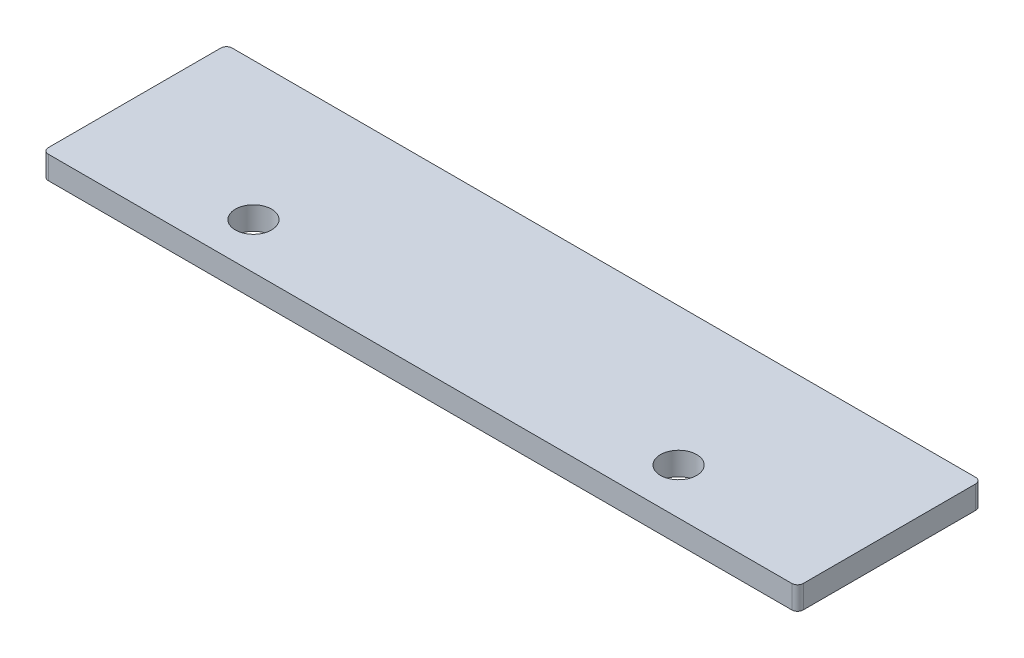
from build123d import *

# Parameters (mm, degrees)
SKETCH_1_W        = 65.7
SKETCH_1_H        = 16
EXTRUDE_1_DEPTH   = 2
FILLET_1_R        = 0.5
HOLE_WIZARD_M31_D = 3.15


with BuildPart() as part:
    # Эскиз1 → Бобышка-Вытянуть1 (new body)
    with BuildSketch(Plane(origin=(0, 0, 0), x_dir=(1, 0, 0), z_dir=(0, 1, 0))):
        Rectangle(SKETCH_1_W, SKETCH_1_H)
    extrude(amount=-EXTRUDE_1_DEPTH)

    # Скругление1
    fillet_1_edges = [part.edges().sort_by_distance(p)[0] for p in [
        (32.85, -1, 8),
        (-32.85, -1, 8),
        (-32.85, -1, -8),
        (32.85, -1, -8),
    ]]
    fillet(fillet_1_edges, radius=FILLET_1_R)

    # Сверло под метчик  спиральное M31 (through all)
    with Locations(Plane(origin=(0, 0, 0), x_dir=(1, 0, 0), z_dir=(0, 1, 0))):
        with Locations((18.5, -4), (-18.5, -4)):
            Hole(HOLE_WIZARD_M31_D / 2)


solid = part.part
